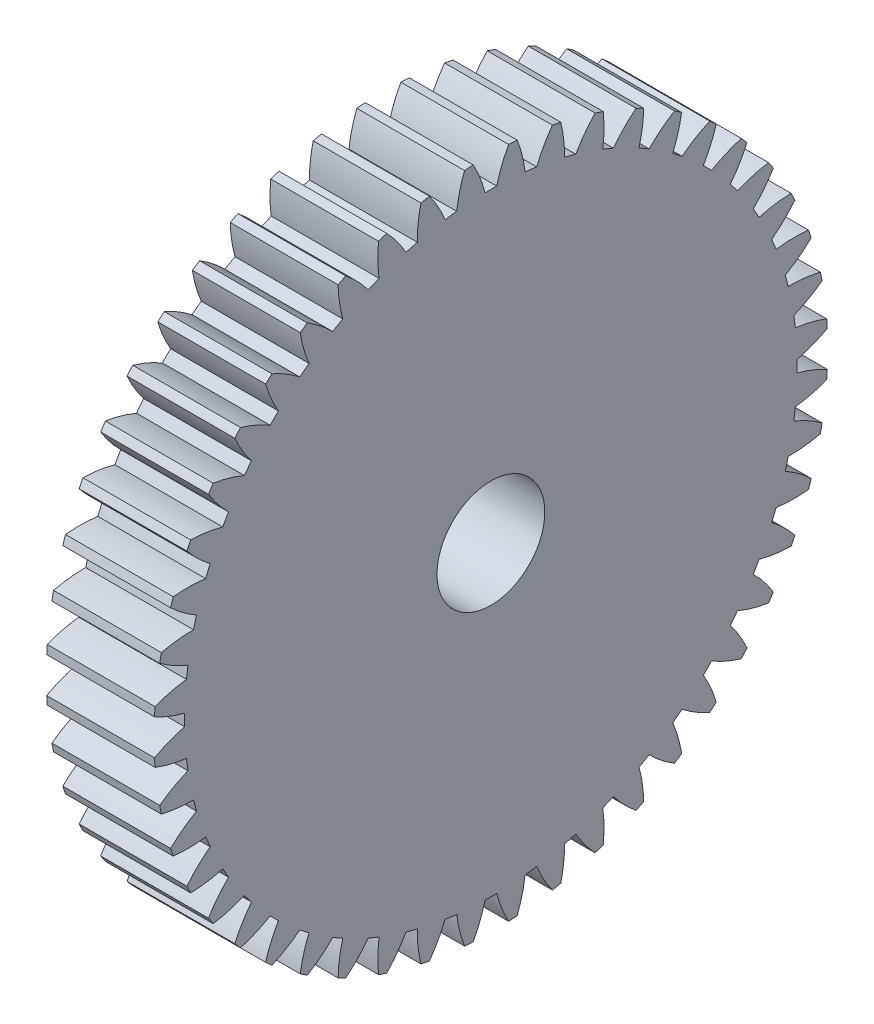
from build123d import *

# Parameters (mm, degrees)
BASPROSKE_W      = 6.35
BASPROSKE_H      = 19.84375
TOOTHCUT_DEPTH   = 29.772753225
TEETHCUTS_COUNT  = 48
TEETHCUTS_ANGLE  = 352.5
HUBNEAONESKE_R   = 6.35
HUBNEARONE_DEPTH = 6.3500508
BORSKE_R         = 3.175
BORE_DEPTH       = 12.7000508


with BuildPart() as part:
    # BasProSke → Base-Revolve (revolve)
    with BuildSketch(Plane(origin=(0, 0, 0), x_dir=(1, 0, 0), z_dir=(0, 1, 0)), mode=Mode.PRIVATE) as base_revolve_sk:
        with Locations((3.175, 9.921875)):
            Rectangle(BASPROSKE_W, BASPROSKE_H)
    revolve(base_revolve_sk.sketch.rotate(Axis((-10, 0, 0), (1, 0, 0)), 180), axis=Axis((-10, 0, 0), (1, 0, 0)))

    # TooCutSke → ToothCut (cut, through all)
    with BuildSketch(Plane(origin=(0, 0, 0), x_dir=(0, 0, -1), z_dir=(1, 0, 0))):
        with BuildLine():
            ThreePointArc((0.34337998, 18.043432907), (0, 18.0467), (-0.34337998, 18.043432907))
            ThreePointArc((-0.34337998, 18.043432907), (-0.643551438, 18.96496793), (-1.058267976, 19.840947321))
            ThreePointArc((-1.058267976, 19.840947321), (0, 19.86915), (1.058267976, 19.840947321))
            ThreePointArc((1.058267976, 19.840947321), (0.643551438, 18.96496793), (0.34337998, 18.043432907))
        make_face()
    toothcut = extrude(amount=TOOTHCUT_DEPTH, mode=Mode.SUBTRACT)

    # TeethCuts: ToothCut ×48 about axis
    teethcuts_axis = Axis((-10, 0, 0), (1, 0, 0))
    for i in range(1, TEETHCUTS_COUNT):
        add(toothcut.rotate(teethcuts_axis, i * TEETHCUTS_ANGLE / (TEETHCUTS_COUNT - 1)), mode=Mode.SUBTRACT)

    # HubNeaOneSke → HubNearOne (add)
    with BuildSketch(Plane.ZY):
        with Locations(Location((0, 0, 0), (0, 0, 180))):
            Circle(HUBNEAONESKE_R)
    extrude(amount=HUBNEARONE_DEPTH)

    # BorSke → Bore (cut, symmetric)
    with BuildSketch(Plane(origin=(0, 0, 0), x_dir=(0, 0, -1), z_dir=(1, 0, 0))):
        with Locations(Location((0, 0, 0), (0, 0, 180))):
            Circle(BORSKE_R)
    extrude(amount=BORE_DEPTH, both=True, mode=Mode.SUBTRACT)


solid = part.part
